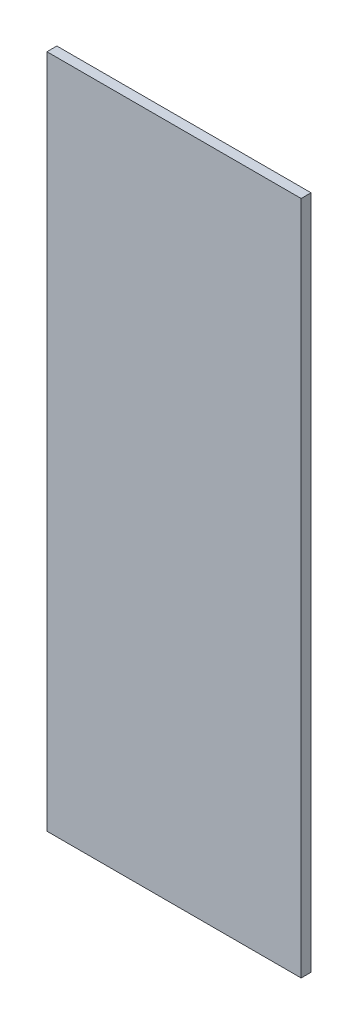
from build123d import *

# Parameters (mm, degrees)
SKETCH1_W           = 51.332398317
SKETCH1_H           = 136.33
BOSS_EXTRUDE2_DEPTH = 2


with BuildPart() as part:
    # Sketch1 → Boss-Extrude2 (new body)
    with BuildSketch(Plane.XY):
        with Locations((-1.288143902, -40.370957779)):
            Rectangle(SKETCH1_W, SKETCH1_H)
    extrude(amount=BOSS_EXTRUDE2_DEPTH)


solid = part.part
